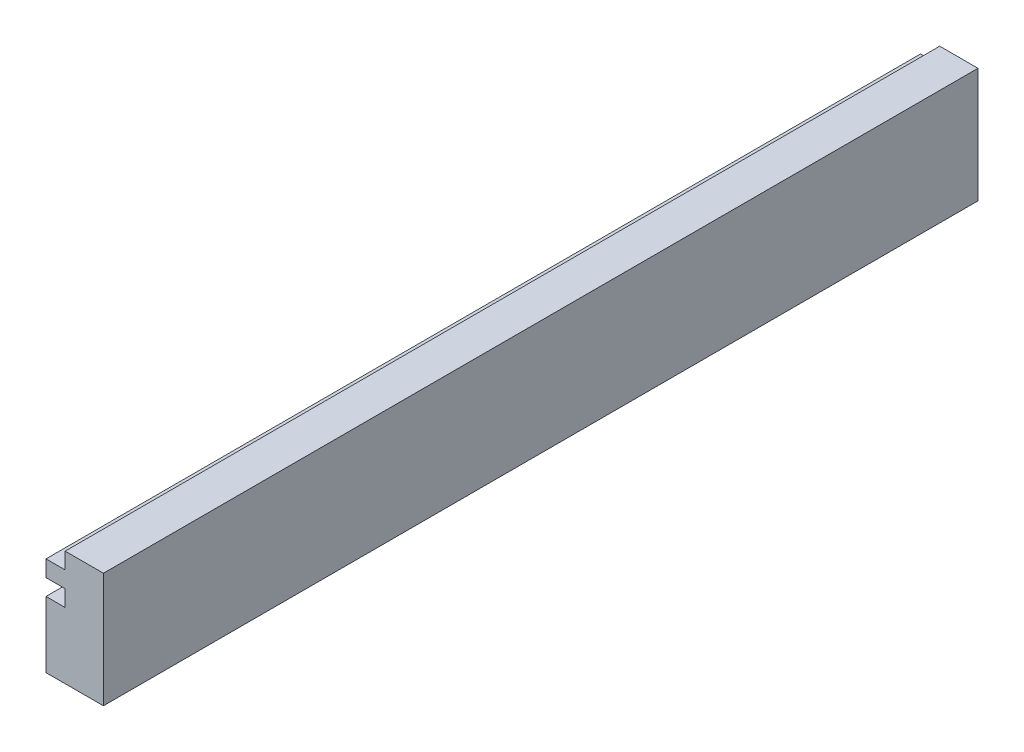
from build123d import *

# Parameters (mm, degrees)
SKETCH1_W           = 30
SKETCH1_H           = 60
BOSS_EXTRUDE1_DEPTH = 457
SKETCH2_W           = 10
SKETCH2_H           = 8.5
CUT_EXTRUDE1_DEPTH  = 500
SKETCH3_W           = 10
SKETCH3_H           = 8.5
CUT_EXTRUDE2_DEPTH  = 42.89


with BuildPart() as part:
    # Sketch1 → Boss-Extrude1 (new body)
    with BuildSketch(Plane.XY):
        with Locations((15, 30)):
            Rectangle(SKETCH1_W, SKETCH1_H)
    extrude(amount=BOSS_EXTRUDE1_DEPTH)

    # Sketch2 → Cut-Extrude1 (cut)
    with BuildSketch(Plane.XY.offset(457)):
        with Locations((5, 38.75)):
            Rectangle(SKETCH2_W, SKETCH2_H)
        with Locations((5, 55.75)):
            Rectangle(SKETCH2_W, SKETCH2_H)
    extrude(amount=-CUT_EXTRUDE1_DEPTH, mode=Mode.SUBTRACT)

    # Sketch3 → Cut-Extrude2 (cut)
    with BuildSketch(Plane(origin=(0, 0, 0), x_dir=(-1, 0, 0), z_dir=(0, 0, -1))):
        with Locations((-5, 21.75)):
            Rectangle(SKETCH3_W, SKETCH3_H)
    extrude(amount=-CUT_EXTRUDE2_DEPTH, mode=Mode.SUBTRACT)


solid = part.part
